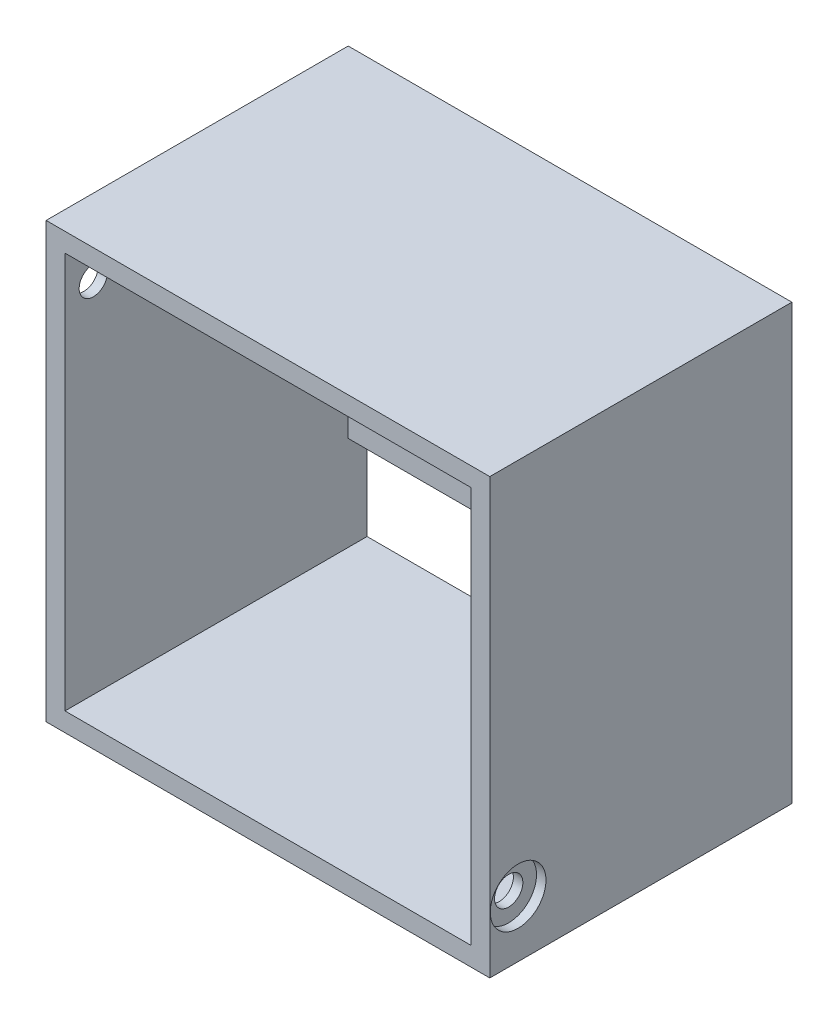
from build123d import *

# Parameters (mm, degrees)
SKETCH1_W         = 47
SKETCH1_H         = 46
SKETCH1_W_2       = 43
SKETCH1_H_2       = 42
WALLS_DEPTH       = 30
SKETCH1_2_W       = 47
SKETCH1_2_H       = 46
SKETCH1_2_W_2     = 43
SKETCH1_2_H_2     = 42
BACK_DEPTH        = 2
SKETCH2_W         = 15
SKETCH2_H         = 10
CABLE_DEPTH       = 2
SKETCH3_R         = 1.5
SETSCREW1_DEPTH   = 2
SKETCH3_6_R       = 2.95
SKETCH3_6_R_2     = 1.5
SETSCREW2_DEPTH   = 1
SETSCREW3_START   = -47
SKETCH3_7_R       = 2.95
SKETCH3_7_R_2     = 1.5
SETSCREW3_DEPTH   = 1
SETSCREW4_START   = -47
SKETCH3_8_R       = 1.5
SETSCREW4_DEPTH   = 2
SKETCH4_W         = 8
SKETCH4_H         = 10
MOUNT_JOINT_DEPTH = 15
SKETCH6_R         = 2.5
JOINT_DEPTH       = 10


with BuildPart() as part:
    # Sketch1 → Walls (new body)
    with BuildSketch(Plane.XY):
        with Locations((-18.175400489, 39.722790127)):
            Rectangle(SKETCH1_W, SKETCH1_H)
        with Locations((-18.175400489, 39.722790127)):
            Rectangle(SKETCH1_W_2, SKETCH1_H_2, mode=Mode.SUBTRACT)
    extrude(amount=WALLS_DEPTH)

    # Sketch1<2> → Back (add)
    # profile 1 of 2: a face of its own
    with BuildSketch(Plane.XY):
        with Locations((-18.175400489, 39.722790127)):
            Rectangle(SKETCH1_2_W, SKETCH1_2_H)
        with Locations((-18.175400489, 39.722790127)):
            Rectangle(SKETCH1_2_W_2, SKETCH1_2_H_2, mode=Mode.SUBTRACT)
    # profile 2 of 2: a face of its own
    with BuildSketch(Plane.XY):
        with Locations((-18.175400489, 39.722790127)):
            Rectangle(SKETCH1_2_W_2, SKETCH1_2_H_2)
    extrude(amount=-BACK_DEPTH)

    # Sketch2 → Cable (cut)
    with BuildSketch(Plane(origin=(0, 0, -2), x_dir=(-1, 0, 0), z_dir=(0, 0, -1))):
        with Locations((32.175400489, 23.722790127)):
            Rectangle(SKETCH2_W, SKETCH2_H)
    extrude(amount=-CABLE_DEPTH, mode=Mode.SUBTRACT)

    # Sketch3 → SetScrew1 (cut)
    with BuildSketch(Plane.ZY.offset(41.675400489)):
        with Locations(Location((27, 56.712532563, 0), (0, 0, 270))):
            Circle(SKETCH3_R)
    extrude(amount=-SETSCREW1_DEPTH, mode=Mode.SUBTRACT)

    # Sketch3<6> → SetScrew2 (cut)
    with BuildSketch(Plane.ZY.offset(41.675400489)):
        with Locations(Location((27, 56.712532563, 0), (0, 0, 270))):
            Circle(SKETCH3_6_R)
        with Locations(Location((27, 56.712532563, 0), (0, 0, 270))):
            Circle(SKETCH3_6_R_2, mode=Mode.SUBTRACT)
    extrude(amount=-SETSCREW2_DEPTH, mode=Mode.SUBTRACT)

    # Sketch3<7> → SetScrew3 (cut)
    with BuildSketch(Plane.ZY.offset(41.675400489).offset(SETSCREW3_START)):
        with Locations(Location((27, 22.733047692, 0), (0, 0, 270))):
            Circle(SKETCH3_7_R)
        with Locations(Location((27, 22.733047692, 0), (0, 0, 270))):
            Circle(SKETCH3_7_R_2, mode=Mode.SUBTRACT)
    extrude(amount=SETSCREW3_DEPTH, mode=Mode.SUBTRACT)

    # Sketch3<8> → SetScrew4 (cut)
    with BuildSketch(Plane.ZY.offset(41.675400489).offset(SETSCREW4_START)):
        with Locations(Location((27, 22.733047692, 0), (0, 0, 270))):
            Circle(SKETCH3_8_R)
    extrude(amount=SETSCREW4_DEPTH, mode=Mode.SUBTRACT)

    # Sketch4 → Mount Joint (add)
    with BuildSketch(Plane(origin=(0, 0, -2), x_dir=(-1, 0, 0), z_dir=(0, 0, -1))):
        with Locations((18.175400489, 34.722790127)):
            Rectangle(SKETCH4_W, SKETCH4_H)
    extrude(amount=MOUNT_JOINT_DEPTH)

    # Sketch6 → Joint (cut)
    with BuildSketch(Plane.ZY.offset(22.175400489)):
        with Locations((-12, 34.722790127)):
            Circle(SKETCH6_R)
    extrude(amount=-JOINT_DEPTH, mode=Mode.SUBTRACT)


solid = part.part
